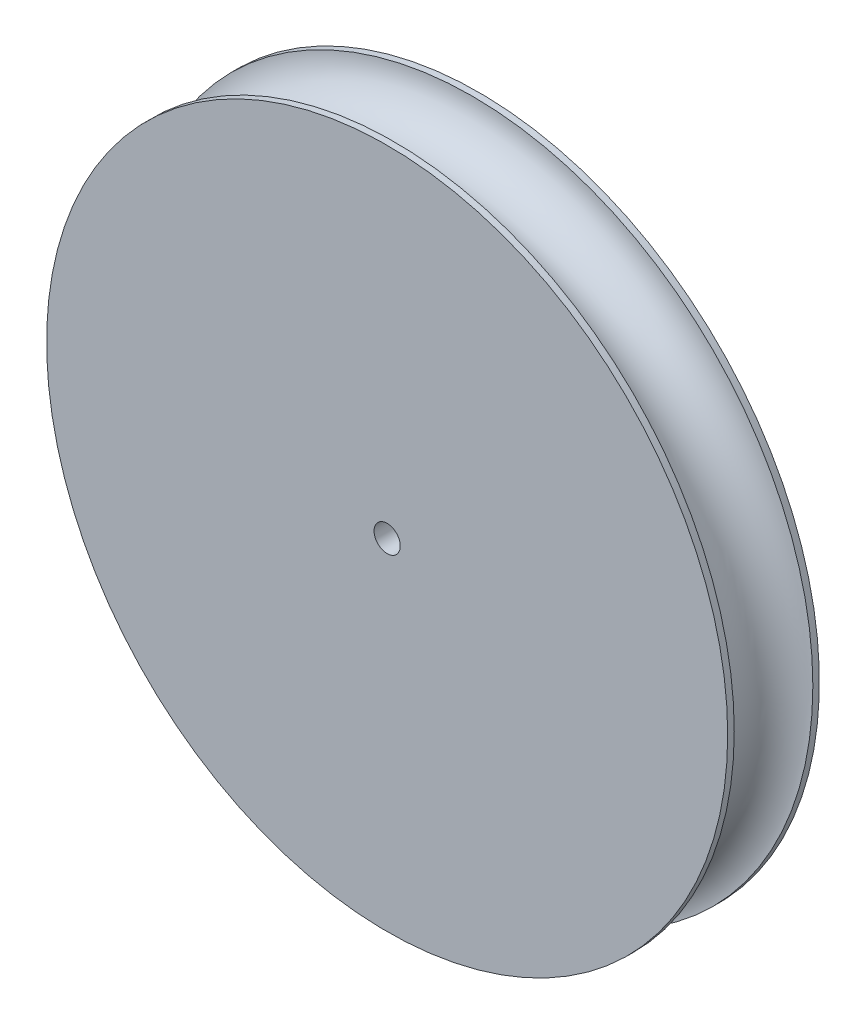
from build123d import *

# Parameters (mm, degrees)
SKETCH1_W           = 23
SKETCH1_H           = 6
SKETCH2_R           = 26
SKETCH2_R_2         = 1
BOSS_EXTRUDE1_DEPTH = 0.5
BOSS_EXTRUDE2_START = 0.5
SKETCH3_R           = 26
BOSS_EXTRUDE2_DEPTH = 0.5
SKETCH4_R           = 1
CUT_EXTRUDE2_DEPTH  = 7


with BuildPart() as part:
    # Sketch1 → Revolve1 (revolve)
    with BuildSketch(Plane(origin=(0, 0, 0), x_dir=(1, 0, 0), z_dir=(0, 1, 0))):
        with BuildLine():
            Line((23, 6), (23, 3))
            ThreePointArc((23, 3), (23.878679656, 5.121320344), (26, 6))
            Line((26, 6), (23, 6))
        make_face()
        with BuildLine():
            Line((23, 3), (23, 0))
            Line((23, 0), (26, 0))
            ThreePointArc((26, 0), (23.878679656, 0.878679656), (23, 3))
        make_face()
        with Locations((11.5, 3)):
            Rectangle(SKETCH1_W, SKETCH1_H)
    revolve(axis=Axis((0, 0, 0), (0, 0, -1)))

    # Sketch2 → Boss-Extrude1 (add)
    with BuildSketch(Plane.XY):
        Circle(SKETCH2_R)
        Circle(SKETCH2_R_2, mode=Mode.SUBTRACT)
    extrude(amount=BOSS_EXTRUDE1_DEPTH)

    # Sketch3 → Boss-Extrude2 (add)
    with BuildSketch(Plane(origin=(0, 0, -6), x_dir=(-1, 0, 0), z_dir=(0, 0, -1)).offset(BOSS_EXTRUDE2_START)):
        with Locations(Location((0, 0, 0), (0, 0, 180))):
            Circle(SKETCH3_R)
    extrude(amount=-BOSS_EXTRUDE2_DEPTH)

    # Sketch4 → Cut-Extrude2 (cut)
    with BuildSketch(Plane(origin=(0, 0, -6.5), x_dir=(-1, 0, 0), z_dir=(0, 0, -1))):
        Circle(SKETCH4_R)
    extrude(amount=-CUT_EXTRUDE2_DEPTH, mode=Mode.SUBTRACT)


solid = part.part
